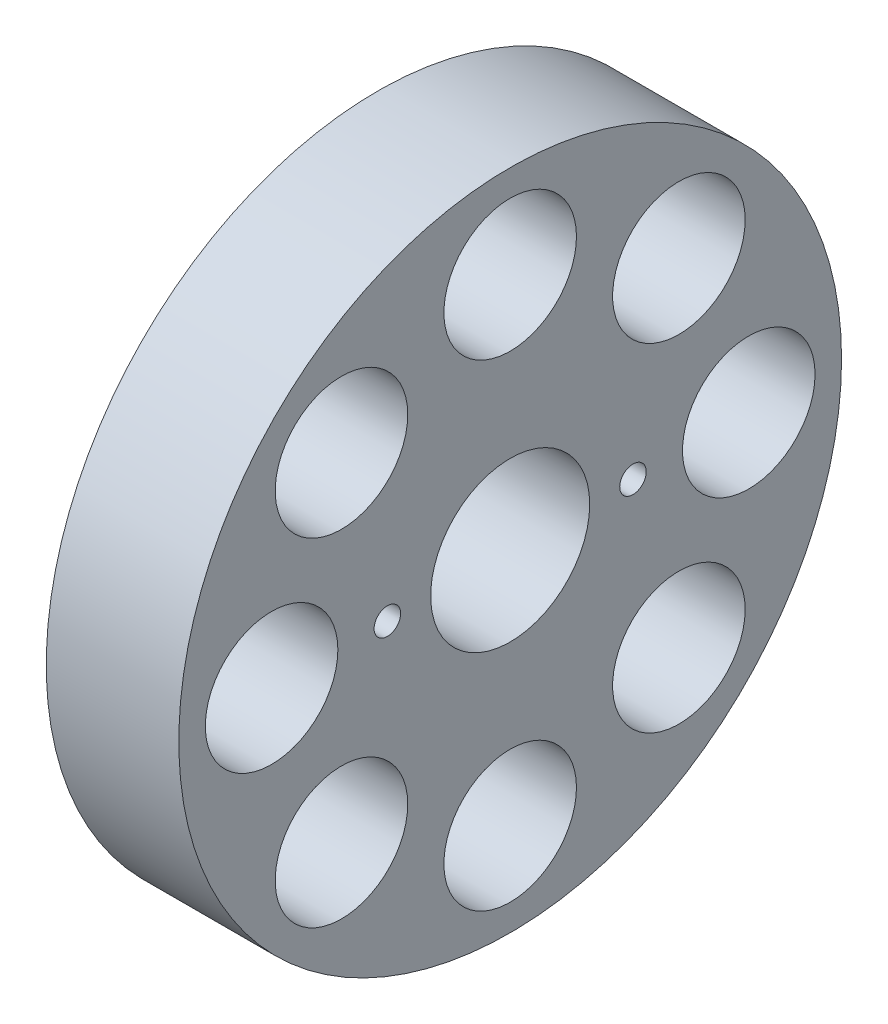
from build123d import *

# Parameters (mm, degrees)
SKETCH1_R           = 25
SKETCH1_R_2         = 5
SKETCH1_R_3         = 6
BOSS_EXTRUDE1_DEPTH = 10
SKETCH2_R           = 1
CUT_EXTRUDE1_DEPTH  = 15


with BuildPart() as part:
    # Sketch1 → Boss-Extrude1 (new body)
    with BuildSketch(Plane(origin=(0, 0, 0), x_dir=(0, 0, -1), z_dir=(1, 0, 0))):
        Circle(SKETCH1_R)
        with Locations((0, 18)):
            Circle(SKETCH1_R_2, mode=Mode.SUBTRACT)
        with Locations((12.727922061, 12.727922061)):
            Circle(SKETCH1_R_2, mode=Mode.SUBTRACT)
        with Locations((18, 0)):
            Circle(SKETCH1_R_2, mode=Mode.SUBTRACT)
        with Locations((12.727922061, -12.727922061)):
            Circle(SKETCH1_R_2, mode=Mode.SUBTRACT)
        with Locations((0, -18)):
            Circle(SKETCH1_R_2, mode=Mode.SUBTRACT)
        with Locations((-12.727922061, -12.727922061)):
            Circle(SKETCH1_R_2, mode=Mode.SUBTRACT)
        with Locations((-18, 0)):
            Circle(SKETCH1_R_2, mode=Mode.SUBTRACT)
        with Locations((-12.727922061, 12.727922061)):
            Circle(SKETCH1_R_2, mode=Mode.SUBTRACT)
        Circle(SKETCH1_R_3, mode=Mode.SUBTRACT)
    extrude(amount=BOSS_EXTRUDE1_DEPTH)

    # Sketch2 → Cut-Extrude1 (cut)
    with BuildSketch(Plane.ZY):
        with Locations((-9.265, 0)):
            Circle(SKETCH2_R)
        with Locations((9.265, 0)):
            Circle(SKETCH2_R)
    extrude(amount=-CUT_EXTRUDE1_DEPTH, mode=Mode.SUBTRACT)


solid = part.part
